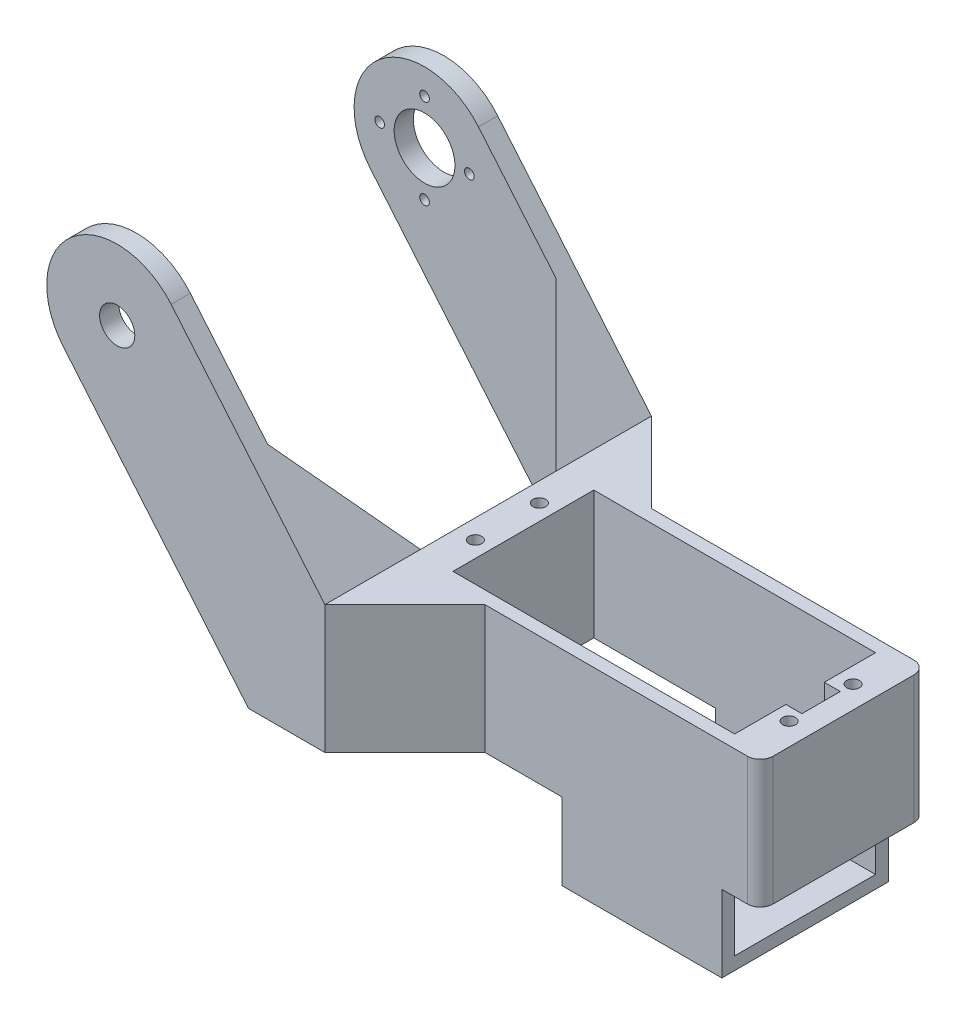
from build123d import *

# Parameters (mm, degrees)
CROQUIS2_W              = 58
CROQUIS2_H              = 26
CROQUIS2_W_2            = 44
CROQUIS2_H_2            = 22
SALIENTE_EXTRUIR3_DEPTH = 20
CROQUIS4_R              = 1
CROQUIS4_W              = 2.5
CROQUIS4_H              = 6
CUT_EXTRUDE1_DEPTH      = 39.327535793
SKETCH1_W               = 51
SKETCH1_H               = 20
BOSS_EXTRUDE1_DEPTH     = 2.5
CROQUIS6_R              = 2.75
SALIENTE_EXTRUIR5_DEPTH = 3
BOSS_EXTRUDE2_START     = -3
SKETCH3_R               = 0.75
SKETCH3_R_2             = 4.75
BOSS_EXTRUDE2_DEPTH     = 3
BOSS_EXTRUDE3_DEPTH     = 25
FILLET1_R               = 2
SKETCH6_R               = 2.15
BOSS_EXTRUDE4_DEPTH     = 5
FILLET4_R               = 1
BOSS_EXTRUDE5_DEPTH     = 20
BOSS_EXTRUDE6_REACH     = 93.885
CUT_EXTRUDE2_DEPTH      = 84.971155352


with BuildPart() as part:
    # Croquis2 → Saliente-Extruir3 (new body)
    with BuildSketch(Plane(origin=(0, 0, 0), x_dir=(1, 0, 0), z_dir=(0, 1, 0))):
        with Locations((-1, 0)):
            Rectangle(CROQUIS2_W, CROQUIS2_H)
        Rectangle(CROQUIS2_W_2, CROQUIS2_H_2, mode=Mode.SUBTRACT)
    extrude(amount=SALIENTE_EXTRUIR3_DEPTH)

    # Croquis4 → Cut-Extrude1 (cut, through all)
    with BuildSketch(Plane(origin=(0, 20, 0), x_dir=(1, 0, 0), z_dir=(0, 1, 0))):
        with Locations(Location((-24.5, 5, 0), (0, 0, 270))):
            Circle(CROQUIS4_R)
        with Locations(Location((-24.5, -5, 0), (0, 0, 270))):
            Circle(CROQUIS4_R)
        with Locations(Location((24.5, -5, 0), (0, 0, 90))):
            Circle(CROQUIS4_R)
        with Locations(Location((24.5, 5, 0), (0, 0, 90))):
            Circle(CROQUIS4_R)
        with Locations((23.25, 0)):
            Rectangle(CROQUIS4_W, CROQUIS4_H)
    extrude(amount=-CUT_EXTRUDE1_DEPTH, mode=Mode.SUBTRACT)

    # Sketch1 → Boss-Extrude1 (add)
    with BuildSketch(Plane.ZY.offset(30)):
        with Locations((0, 10)):
            Rectangle(SKETCH1_W, SKETCH1_H)
    extrude(amount=-BOSS_EXTRUDE1_DEPTH)

    # Croquis6 → Saliente-Extruir5 (add)
    with BuildSketch(Plane.XY.offset(25.5)):
        with BuildLine():
            Line((-39.436967742, 0), (-30, 0))
            Line((-30, 0), (-30, 20))
            Line((-30, 20), (-27.5, 20))
            Line((-27.5, 20), (-51.509432429, 48.613327353))
            ThreePointArc((-51.509432429, 48.613327353), (-67.00658501, 49.969152521), (-68.362410178, 34.47199994))
            Line((-68.362410178, 34.47199994), (-39.436967742, 0))
        make_face()
        with Locations((-59.935921303, 41.542663647)):
            Circle(CROQUIS6_R, mode=Mode.SUBTRACT)
    extrude(amount=-SALIENTE_EXTRUIR5_DEPTH)

    # Sketch3 → Boss-Extrude2 (add)
    with BuildSketch(Plane(origin=(0, 0, -25.5), x_dir=(-1, 0, 0), z_dir=(0, 0, -1)).offset(BOSS_EXTRUDE2_START)):
        with BuildLine():
            Line((51.509432429, 48.613327353), (27.5, 20))
            Line((27.5, 20), (30, 20))
            Line((30, 20), (30, 0))
            Line((30, 0), (39.436967742, 0))
            Line((39.436967742, 0), (68.362410178, 34.47199994))
            ThreePointArc((68.362410178, 34.47199994), (67.00658501, 49.969152521), (51.509432429, 48.613327353))
        make_face()
        with Locations((66.935921303, 41.542663647)):
            Circle(SKETCH3_R, mode=Mode.SUBTRACT)
        with Locations((59.935921303, 34.542663647)):
            Circle(SKETCH3_R, mode=Mode.SUBTRACT)
        with Locations((59.935921303, 48.542663647)):
            Circle(SKETCH3_R, mode=Mode.SUBTRACT)
        with Locations((52.935921303, 41.542663647)):
            Circle(SKETCH3_R, mode=Mode.SUBTRACT)
        with Locations((59.935921303, 41.542663647)):
            Circle(SKETCH3_R_2, mode=Mode.SUBTRACT)
    extrude(amount=BOSS_EXTRUDE2_DEPTH)

    # Sketch5 → Boss-Extrude3 (add)
    with BuildSketch(Plane(origin=(22, 0, 0), x_dir=(0, 0, -1), z_dir=(1, 0, 0))):
        Polygon((-13, 0), (-13, -12), (13, -12), (13, 0), (11, 0), (11, -10), (-11, -10), (-11, 0), align=None)
    extrude(amount=-BOSS_EXTRUDE3_DEPTH)

    # Fillet1
    fillet1_edges = [part.edges().sort_by_distance(p)[0] for p in [
        (28, 10, -13),
        (28, 10, 13),
    ]]
    fillet(fillet1_edges, radius=FILLET1_R)

    # Sketch6 → Boss-Extrude4 (add)
    with BuildSketch(Plane.XZ.offset(12)):
        with Locations(Location((10, 0, 0), (0, 0, 270))):
            Circle(SKETCH6_R)
    extrude(amount=BOSS_EXTRUDE4_DEPTH)

    # Fillet4
    fillet4_edges = [part.edges().sort_by_distance(p)[0] for p in [
        (10, -12, 2.15),
    ]]
    fillet(fillet4_edges, radius=FILLET4_R)

    # Sketch8 → Boss-Extrude5 (add)
    with BuildSketch(Plane(origin=(0, 20, 0), x_dir=(1, 0, 0), z_dir=(0, 1, 0))):
        Polygon((-27.5, 25.5), (-27.5, 13), (-15, 13), align=None)
        Polygon((-27.5, -13), (-15, -13), (-27.5, -25.5), align=None)
    extrude(amount=-BOSS_EXTRUDE5_DEPTH)

    # Boss-Extrude6: up to this plane
    boss_extrude6_end = Plane(origin=(-6.289584913, -5.277588381, 22.5), z_dir=(0.76604444311898, 0.642787609686537, 0))
    # Sketch9 → Boss-Extrude6 (add, up to the surface)
    with BuildSketch(Plane.XZ, mode=Mode.PRIVATE) as boss_extrude6_sk1:
        Polygon((-39.436967742, 22.5), (-26.5, 9.563032258), (-26.5, 22.5), align=None)
    boss_extrude6_tool1 = split(extrude(boss_extrude6_sk1.sketch, amount=-BOSS_EXTRUDE6_REACH, mode=Mode.PRIVATE), bisect_by=boss_extrude6_end, keep=Keep.BOTH, mode=Mode.PRIVATE)
    add(boss_extrude6_tool1.solids().sort_by_distance((-30.812323, 0, 18.187677))[0])
    # Sketch9 → Boss-Extrude6 (add, up to the surface)
    with BuildSketch(Plane.XZ, mode=Mode.PRIVATE) as boss_extrude6_sk2:
        Polygon((-26.5, -9.563032258), (-26.5, -22.5), (-39.436967742, -22.5), align=None)
    boss_extrude6_tool2 = split(extrude(boss_extrude6_sk2.sketch, amount=-BOSS_EXTRUDE6_REACH, mode=Mode.PRIVATE), bisect_by=boss_extrude6_end, keep=Keep.BOTH, mode=Mode.PRIVATE)
    add(boss_extrude6_tool2.solids().sort_by_distance((-30.812323, 0, -18.187677))[0])

    # Sketch10 → Cut-Extrude2 (cut, through all)
    with BuildSketch(Plane(origin=(0, 20, 0), x_dir=(1, 0, 0), z_dir=(0, 1, 0))):
        Polygon((-30, 13.063032258), (-30, -13.063032258), (-27.5, -10.563032258), (-27.5, 10.563032258), align=None)
    extrude(amount=-CUT_EXTRUDE2_DEPTH, mode=Mode.SUBTRACT)


solid = part.part
